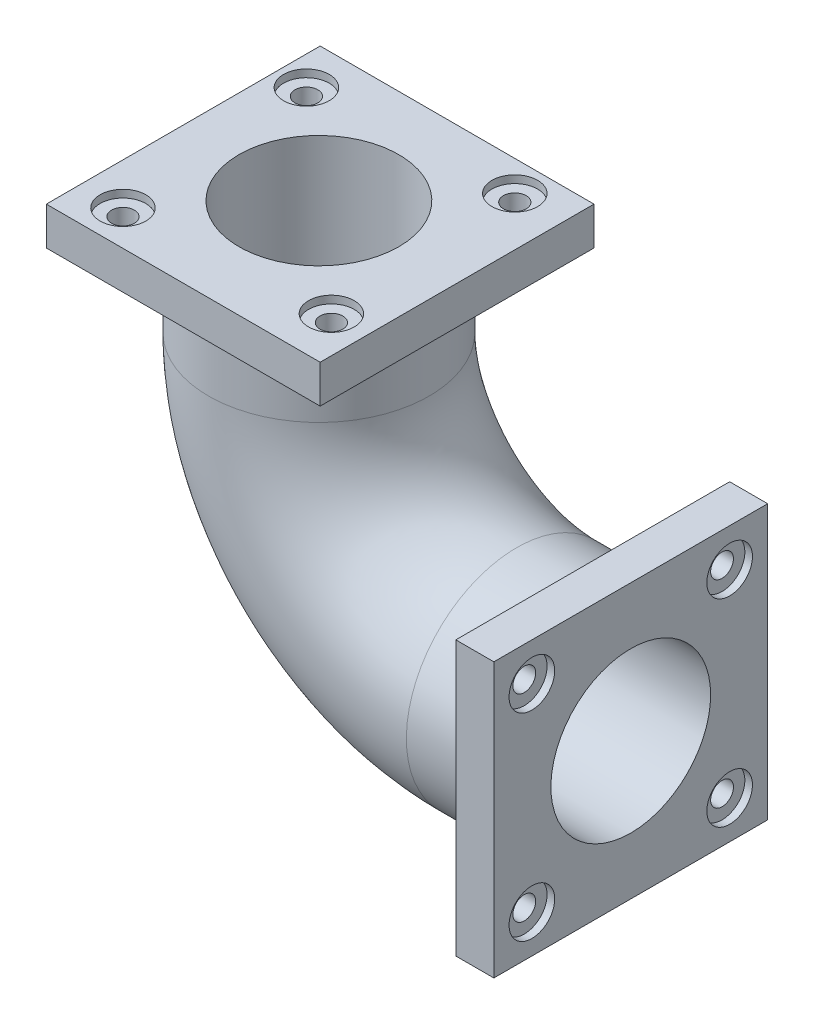
from build123d import *

# Parameters (mm, degrees)
SKETCH2_R           = 145
SKETCH2_R_2         = 105
BOSS_EXTRUDE1_START = -50
SKETCH3_W           = 360
SKETCH3_H           = 360
SKETCH3_R           = 145
BOSS_EXTRUDE1_DEPTH = 50
SKETCH4_W           = 360
SKETCH4_H           = 360
SKETCH4_R           = 145
BOSS_EXTRUDE2_DEPTH = 50
SKETCH5_R           = 30
CUT_EXTRUDE1_DEPTH  = 10
SKETCH6_R           = 15
CUT_EXTRUDE2_DEPTH  = 48
CIRPATTERN1_COUNT   = 4
SKETCH8_R           = 30
CUT_EXTRUDE3_DEPTH  = 10
SKETCH9_R           = 15
CUT_EXTRUDE4_DEPTH  = 49
CIRPATTERN2_COUNT   = 4


with BuildPart() as part:
    # Sweep-Thin1: sweep along a path in Sketch1
    with BuildLine(Plane.XY) as sweep_thin1_path:
        Line((0, 0), (-150, 0))
        ThreePointArc((-150, 0), (-333.847763109, 76.152236891), (-410, 260))
        Line((-410, 260), (-410, 410))
    # Sketch2 → Sweep-Thin1 (sweep)
    with BuildSketch(Plane(origin=(0, 0, 0), x_dir=(0, 0, -1), z_dir=(1, 0, 0))):
        Circle(SKETCH2_R)
        Circle(SKETCH2_R_2, mode=Mode.SUBTRACT)
    sweep(path=sweep_thin1_path.line)

    # Sketch3 → Boss-Extrude1 (add)
    with BuildSketch(Plane(origin=(0, 0, 0), x_dir=(0, 0, -1), z_dir=(1, 0, 0)).offset(BOSS_EXTRUDE1_START)):
        Rectangle(SKETCH3_W, SKETCH3_H)
        with Locations(Location((0, 0, 0), (0, 0, 270))):
            Circle(SKETCH3_R, mode=Mode.SUBTRACT)
    extrude(amount=BOSS_EXTRUDE1_DEPTH)

    # Sketch4 → Boss-Extrude2 (add)
    with BuildSketch(Plane(origin=(0, 410, 0), x_dir=(1, 0, 0), z_dir=(0, 1, 0))):
        with Locations((-405.27054164, -3.074605453)):
            Rectangle(SKETCH4_W, SKETCH4_H)
        with Locations(Location((-410, 0, 0), (0, 0, 180))):
            Circle(SKETCH4_R, mode=Mode.SUBTRACT)
    extrude(amount=-BOSS_EXTRUDE2_DEPTH)

    # Sketch5 → Cut-Extrude1 (cut)
    with BuildSketch(Plane(origin=(0, 410, 0), x_dir=(1, 0, 0), z_dir=(0, 1, 0))):
        with Locations(Location((-547.00142426, 120.556062023, 0), (0, 0, 180))):
            Circle(SKETCH5_R)
    cut_extrude1 = extrude(amount=-CUT_EXTRUDE1_DEPTH, mode=Mode.SUBTRACT)

    # Sketch6 → Cut-Extrude2 (cut)
    with BuildSketch(Plane(origin=(0, 400, 0), x_dir=(1, 0, 0), z_dir=(0, 1, 0))):
        with Locations(Location((-547.00142426, 120.556062023, 0), (0, 0, 180))):
            Circle(SKETCH6_R)
    cut_extrude2 = extrude(amount=-CUT_EXTRUDE2_DEPTH, mode=Mode.SUBTRACT)

    # CirPattern1: Cut-Extrude1, Cut-Extrude2 ×4 about axis
    cirpattern1_axis = Axis((-410, 0, 0), (0, 1, 0))
    add([cut_extrude1.rotate(cirpattern1_axis, i * 360 / CIRPATTERN1_COUNT) for i in range(1, CIRPATTERN1_COUNT)], mode=Mode.SUBTRACT)
    add([cut_extrude2.rotate(cirpattern1_axis, i * 360 / CIRPATTERN1_COUNT) for i in range(1, CIRPATTERN1_COUNT)], mode=Mode.SUBTRACT)

    # Sketch8 → Cut-Extrude3 (cut)
    with BuildSketch(Plane(origin=(0, 0, 0), x_dir=(0, 0, -1), z_dir=(1, 0, 0))):
        with Locations((-130, 130)):
            Circle(SKETCH8_R)
    cut_extrude3 = extrude(amount=-CUT_EXTRUDE3_DEPTH, mode=Mode.SUBTRACT)

    # Sketch9 → Cut-Extrude4 (cut)
    with BuildSketch(Plane(origin=(-10, 0, 0), x_dir=(0, 0, -1), z_dir=(1, 0, 0))):
        with Locations((-130, 130)):
            Circle(SKETCH9_R)
    cut_extrude4 = extrude(amount=-CUT_EXTRUDE4_DEPTH, mode=Mode.SUBTRACT)

    # CirPattern2: Cut-Extrude3, Cut-Extrude4 ×4 about axis
    cirpattern2_axis = Axis((0, 0, 0), (1, 0, 0))
    add([cut_extrude3.rotate(cirpattern2_axis, i * 360 / CIRPATTERN2_COUNT) for i in range(1, CIRPATTERN2_COUNT)], mode=Mode.SUBTRACT)
    add([cut_extrude4.rotate(cirpattern2_axis, i * 360 / CIRPATTERN2_COUNT) for i in range(1, CIRPATTERN2_COUNT)], mode=Mode.SUBTRACT)


solid = part.part
